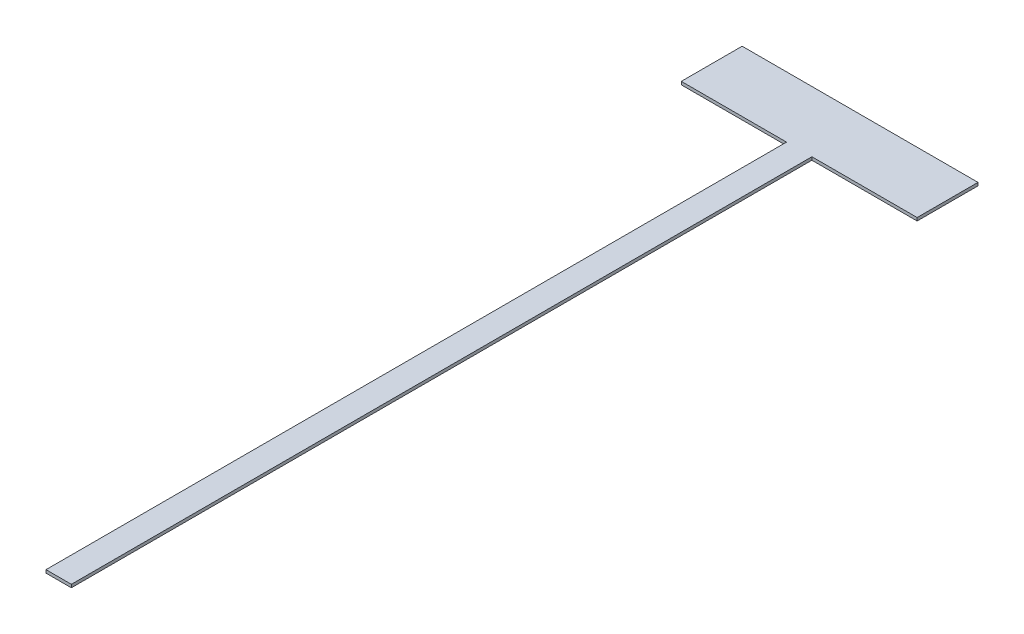
from build123d import *

# Parameters (mm, degrees)
BOSS_EXTRUDE1_DEPTH = 1.2


with BuildPart() as part:
    # Sketch1 → Boss-Extrude1 (new body)
    with BuildSketch(Plane(origin=(0, 0, 0), x_dir=(1, 0, 0), z_dir=(0, 1, 0))):
        Polygon((-46.5, 24), (-46.5, 0), (-5, 0), (-5, -292), (5, -292), (5, 0), (46.5, 0), (46.5, 24), align=None)
    extrude(amount=BOSS_EXTRUDE1_DEPTH)


solid = part.part
